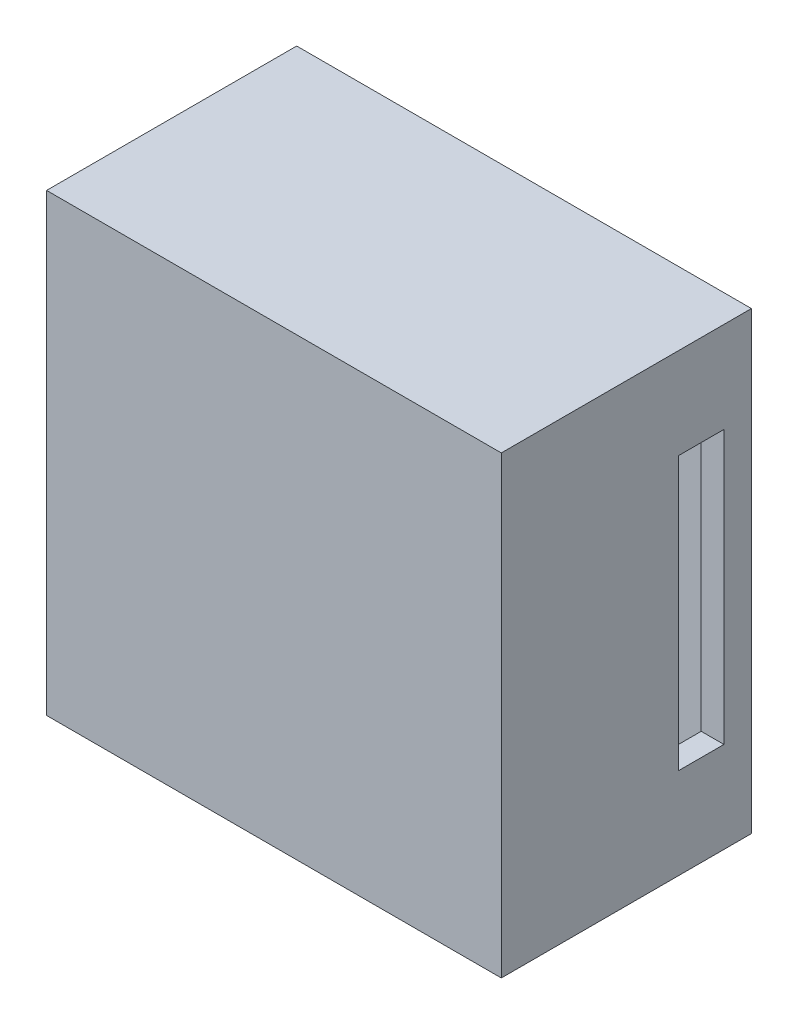
from build123d import *

# Parameters (mm, degrees)
SKETCH1_W           = 100
SKETCH1_H           = 100
BOSS_EXTRUDE1_DEPTH = 50
SHELL1_T            = -5
SKETCH2_W           = 10
SKETCH2_H           = 60
CUT_EXTRUDE1_DEPTH  = 19
SKETCH3_W           = 100
SKETCH3_H           = 100
BOSS_EXTRUDE2_DEPTH = 5


with BuildPart() as part:
    # Sketch1 → Boss-Extrude1 (new body)
    with BuildSketch(Plane.XY):
        Rectangle(SKETCH1_W, SKETCH1_H)
    extrude(amount=BOSS_EXTRUDE1_DEPTH)

    # Shell1
    shell1_openings = [part.faces().sort_by_distance(p)[0] for p in [
        (0, 0, 50),
    ]]
    offset(amount=SHELL1_T, openings=shell1_openings, kind=Kind.INTERSECTION)

    # Sketch2 → Cut-Extrude1 (cut)
    with BuildSketch(Plane(origin=(50, 0, 0), x_dir=(0, 0, -1), z_dir=(1, 0, 0))):
        with Locations((-11.04097714, 0)):
            Rectangle(SKETCH2_W, SKETCH2_H)
    extrude(amount=-CUT_EXTRUDE1_DEPTH, mode=Mode.SUBTRACT)

    # Sketch3 → Boss-Extrude2 (add)
    with BuildSketch(Plane.XY.offset(50)):
        Rectangle(SKETCH3_W, SKETCH3_H)
    extrude(amount=BOSS_EXTRUDE2_DEPTH)


solid = part.part
